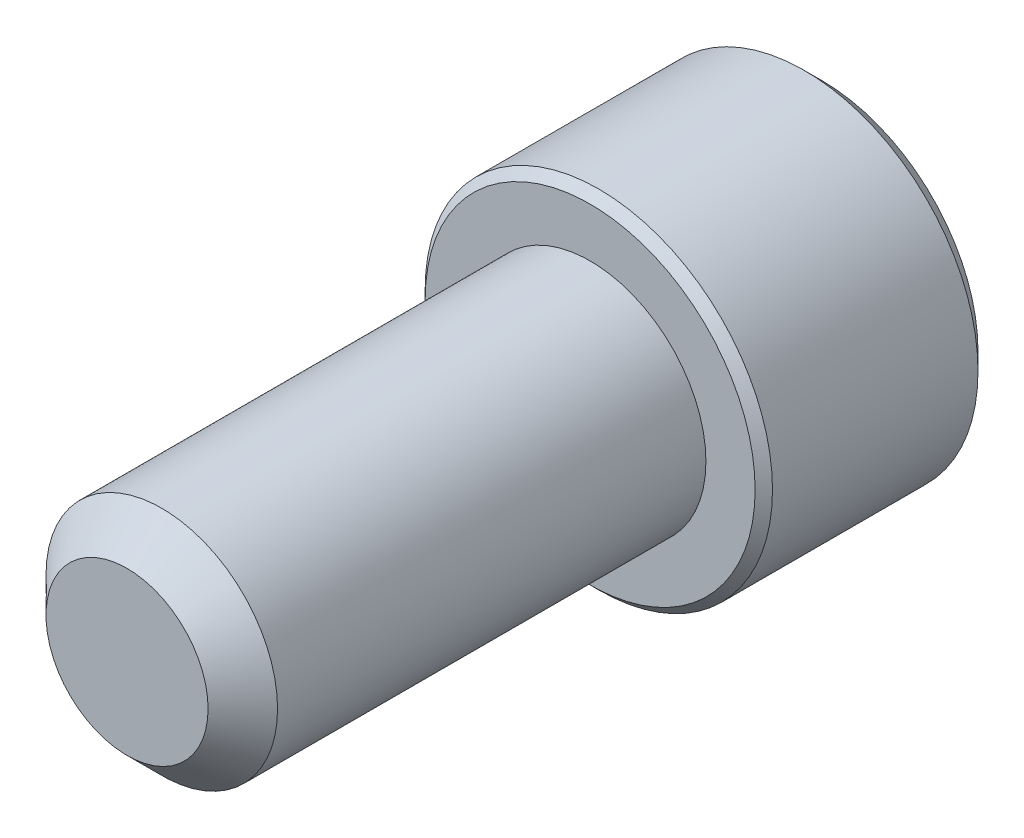
from build123d import *

# Parameters (mm, degrees)
SKETCH1_R          = 3.175
EXTRUDE1_DEPTH     = 12.7
CHAMFER3_SIZE      = 0.9525
SKETCH6_R          = 4.7625
EXTRUDE2_DEPTH     = 6.35
CUT_EXTRUDE1_DEPTH = 3.571875
CHAMFER1_SIZE      = 0.47625
CHAMFER2_SIZE      = 0.238125


with BuildPart() as part:
    # Sketch1 → Extrude1 (new body)
    with BuildSketch(Plane.XY):
        Circle(SKETCH1_R)
    extrude(amount=-EXTRUDE1_DEPTH)

    # Chamfer3
    chamfer3_edges = [part.edges().sort_by_distance(p)[0] for p in [
        (-3.175, 0, 0),
    ]]
    chamfer(chamfer3_edges, length=CHAMFER3_SIZE)

    # Sketch6 → Extrude2 (add)
    with BuildSketch(Plane(origin=(0, 0, -12.7), x_dir=(-1, 0, 0), z_dir=(0, 0, -1))):
        Circle(SKETCH6_R)
    extrude(amount=EXTRUDE2_DEPTH)

    # Sketch7 → Cut-Extrude1 (cut)
    with BuildSketch(Plane(origin=(0, 0, -19.05), x_dir=(-1, 0, 0), z_dir=(0, 0, -1))):
        Polygon((0, 2.749630657), (-2.38125, 1.374815329), (-2.38125, -1.374815329), (0, -2.749630657), (2.38125, -1.374815329), (2.38125, 1.374815329), align=None)
    extrude(amount=-CUT_EXTRUDE1_DEPTH, mode=Mode.SUBTRACT)

    # Chamfer1
    chamfer1_edges = [part.edges().sort_by_distance(p)[0] for p in [
        (4.7625, 0, -19.05),
    ]]
    chamfer(chamfer1_edges, length=CHAMFER1_SIZE)

    # Chamfer2
    chamfer2_edges = [part.edges().sort_by_distance(p)[0] for p in [
        (4.7625, 0, -12.7),
    ]]
    chamfer(chamfer2_edges, length=CHAMFER2_SIZE)


solid = part.part
